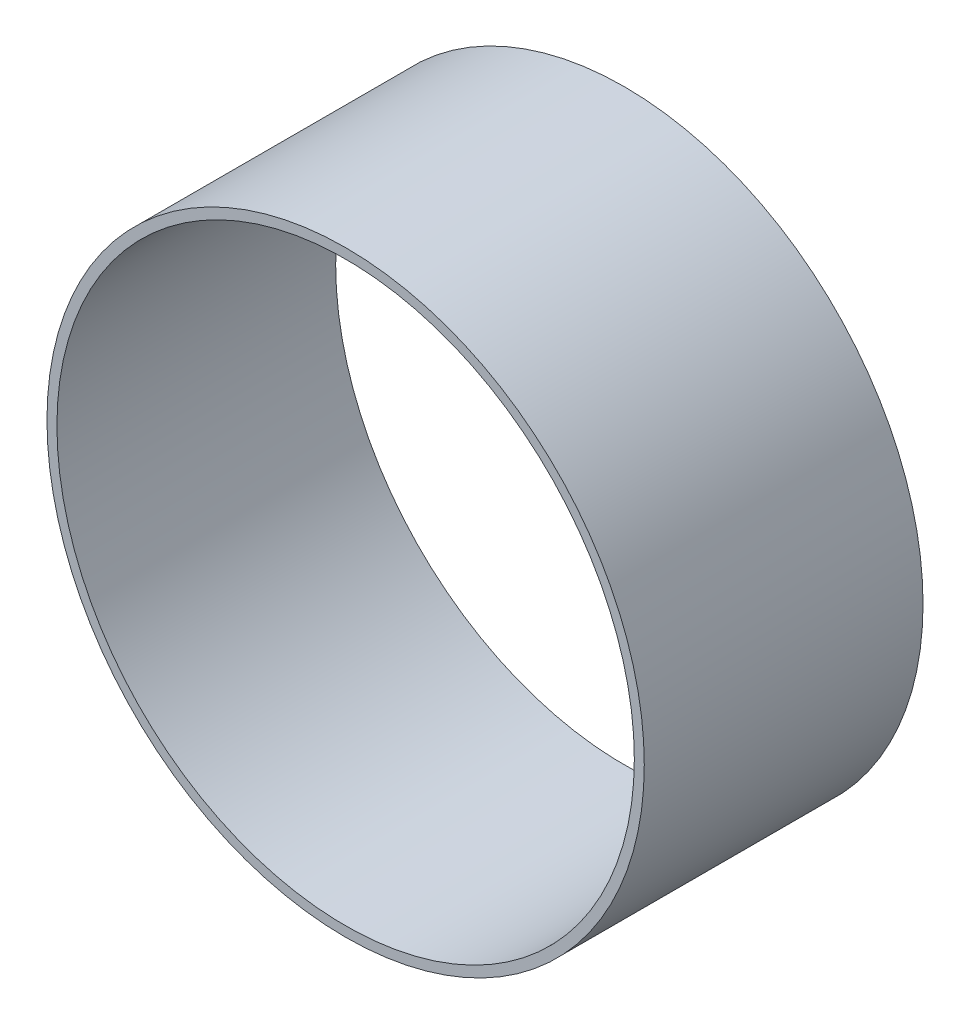
from build123d import *

# Parameters (mm, degrees)
ESQUISSE1_R        = 30
ESQUISSE1_R_2      = 29
BOSS_EXTRU_1_DEPTH = 28


with BuildPart() as part:
    # Esquisse1 → Boss.-Extru.1 (new body)
    with BuildSketch(Plane.XY):
        Circle(ESQUISSE1_R)
        Circle(ESQUISSE1_R_2, mode=Mode.SUBTRACT)
    extrude(amount=BOSS_EXTRU_1_DEPTH)


solid = part.part
